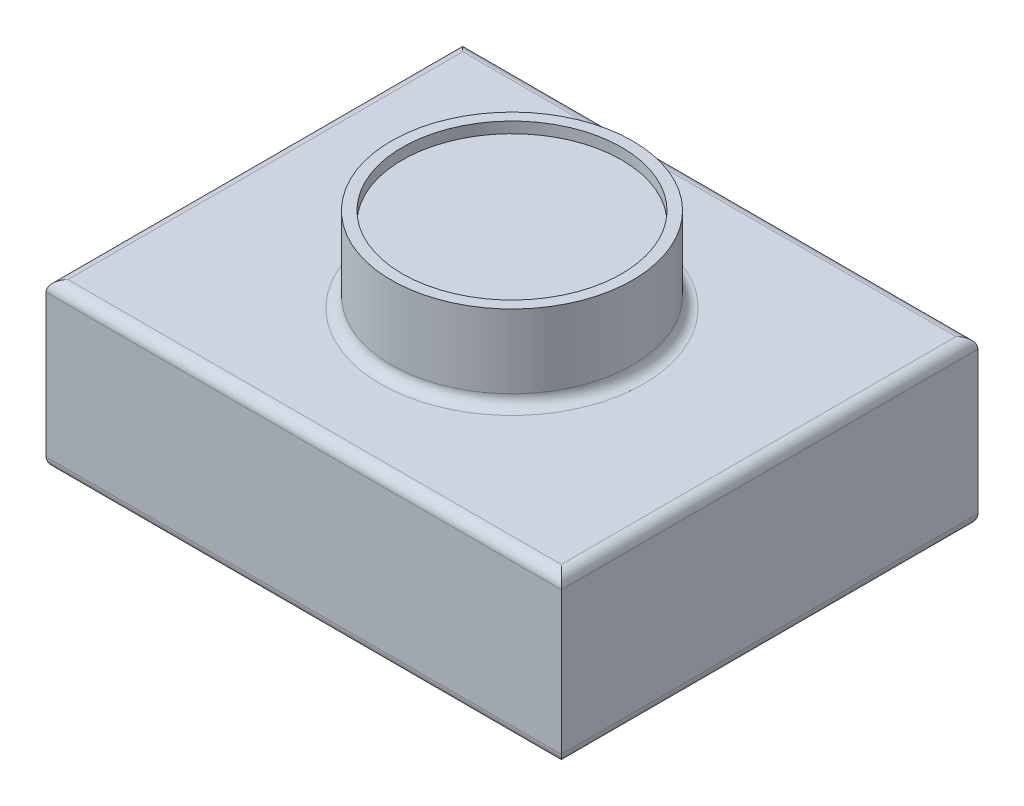
from build123d import *

# Parameters (mm, degrees)
SKETCH_1_W          = 47
SKETCH_1_H          = 38
EXTRUDE_1_DEPTH     = 15
SKETCH_2_R          = 11
EXTRUDE_2_DEPTH     = 7.7
FILLET_1_R          = 1
SKETCH_3_R          = 1.5
SKETCH_3_W          = 9
SKETCH_3_H          = 6
CUT_EXTRUDE_1_DEPTH = 5
SKETCH_4_W          = 6
SKETCH_4_H          = 4
EXTRUDE_3_DEPTH     = 5
SKETCH_5_R          = 10
CUT_EXTRUDE_2_DEPTH = 1


with BuildPart() as part:
    # 草图1 → 凸台-拉伸1 (new body)
    with BuildSketch(Plane(origin=(0, 0, 0), x_dir=(1, 0, 0), z_dir=(0, 1, 0))):
        Rectangle(SKETCH_1_W, SKETCH_1_H)
    extrude(amount=EXTRUDE_1_DEPTH)

    # 草图2 → 凸台-拉伸2 (add)
    with BuildSketch(Plane(origin=(0, 15, 0), x_dir=(1, 0, 0), z_dir=(0, 1, 0))):
        with Locations(Location((0, 0, 0), (0, 0, 90))):
            Circle(SKETCH_2_R)
    extrude(amount=EXTRUDE_2_DEPTH)

    # 圆角1
    fillet_1_edges = [part.edges().sort_by_distance(p)[0] for p in [
        (-23.5, 15, 0),
        (0, 15, 11),
        (0, 15, 19),
        (23.5, 15, 0),
        (0, 0, 19),
        (-23.5, 0, 0),
        (0, 0, -19),
        (23.5, 0, 0),
        (0, 15, -19),
    ]]
    fillet(fillet_1_edges, radius=FILLET_1_R)

    # 草图3 → 切除-拉伸1 (cut)
    with BuildSketch(Plane.XZ):
        with Locations(Location((19.5, 14, 0), (0, 0, 270))):
            Circle(SKETCH_3_R)
        with Locations(Location((-19.5, 14, 0), (0, 0, 270))):
            Circle(SKETCH_3_R)
        with Locations(Location((-19.5, -14, 0), (0, 0, 270))):
            Circle(SKETCH_3_R)
        with Locations(Location((19.5, -14, 0), (0, 0, 270))):
            Circle(SKETCH_3_R)
        with Locations((-7, 13)):
            Rectangle(SKETCH_3_W, SKETCH_3_H)
    extrude(amount=-CUT_EXTRUDE_1_DEPTH, mode=Mode.SUBTRACT)

    # 草图4 → 凸台-拉伸3 (add)
    with BuildSketch(Plane.XZ.offset(-5)):
        with Locations((-7, 13)):
            Rectangle(SKETCH_4_W, SKETCH_4_H)
    extrude(amount=EXTRUDE_3_DEPTH)

    # 草图5 → 切除-拉伸2 (cut)
    with BuildSketch(Plane(origin=(0, 22.7, 0), x_dir=(1, 0, 0), z_dir=(0, 1, 0))):
        with Locations(Location((0, 0, 0), (0, 0, 270))):
            Circle(SKETCH_5_R)
    extrude(amount=-CUT_EXTRUDE_2_DEPTH, mode=Mode.SUBTRACT)


solid = part.part
